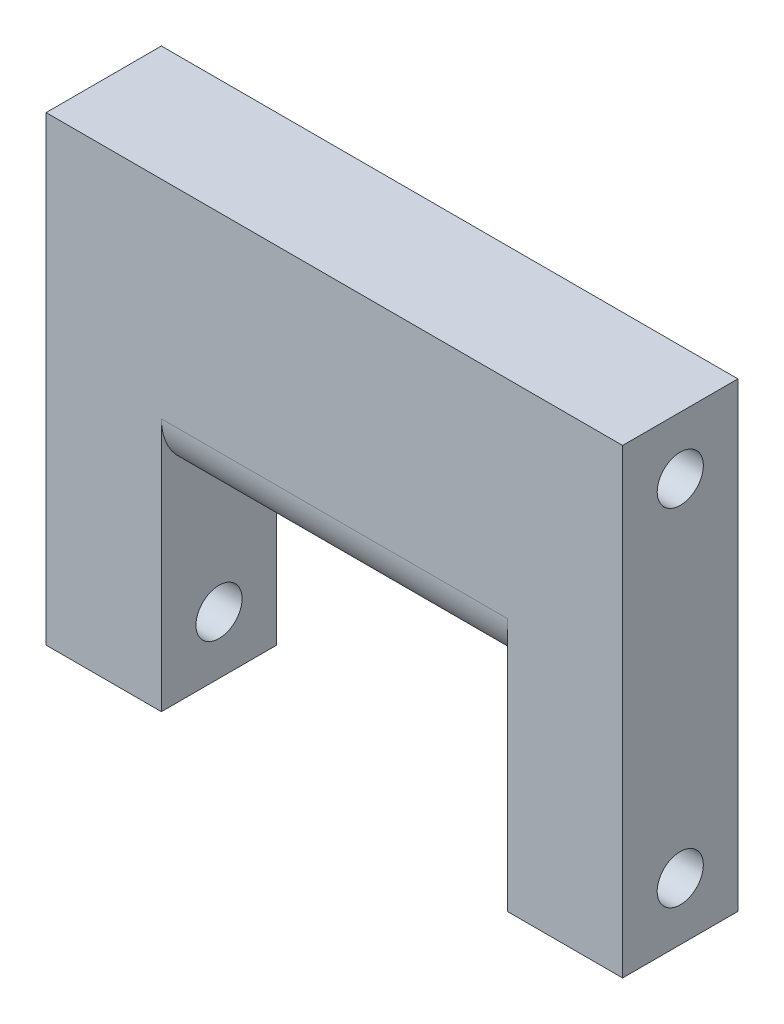
from build123d import *

# Parameters (mm, degrees)
BOSS_EXTRUDE1_DEPTH = 10
SKETCH2_R           = 2
CUT_EXTRUDE1_DEPTH  = 65.807406984
FILLET1_R           = 5
SKETCH3_R           = 2
CUT_EXTRUDE2_DEPTH  = 65.807406984


with BuildPart() as part:
    # Sketch1 → Boss-Extrude1 (new body)
    with BuildSketch(Plane.XY):
        Polygon((40, 0), (50, 0), (50, 40), (0, 40), (0, 0), (10, 0), (10, 17), (40, 17), align=None)
    extrude(amount=BOSS_EXTRUDE1_DEPTH)

    # Sketch2 → Cut-Extrude1 (cut, through all)
    with BuildSketch(Plane(origin=(50, 0, 0), x_dir=(0, 0, -1), z_dir=(1, 0, 0))):
        with Locations((-5, 5)):
            Circle(SKETCH2_R)
    extrude(amount=-CUT_EXTRUDE1_DEPTH, mode=Mode.SUBTRACT)

    # Fillet1
    fillet1_edges = [part.edges().sort_by_distance(p)[0] for p in [
        (25, 17, 10),
    ]]
    fillet(fillet1_edges, radius=FILLET1_R)

    # Sketch3 → Cut-Extrude2 (cut, through all)
    with BuildSketch(Plane.ZY):
        with Locations((5, 35)):
            Circle(SKETCH3_R)
    extrude(amount=-CUT_EXTRUDE2_DEPTH, mode=Mode.SUBTRACT)


solid = part.part
